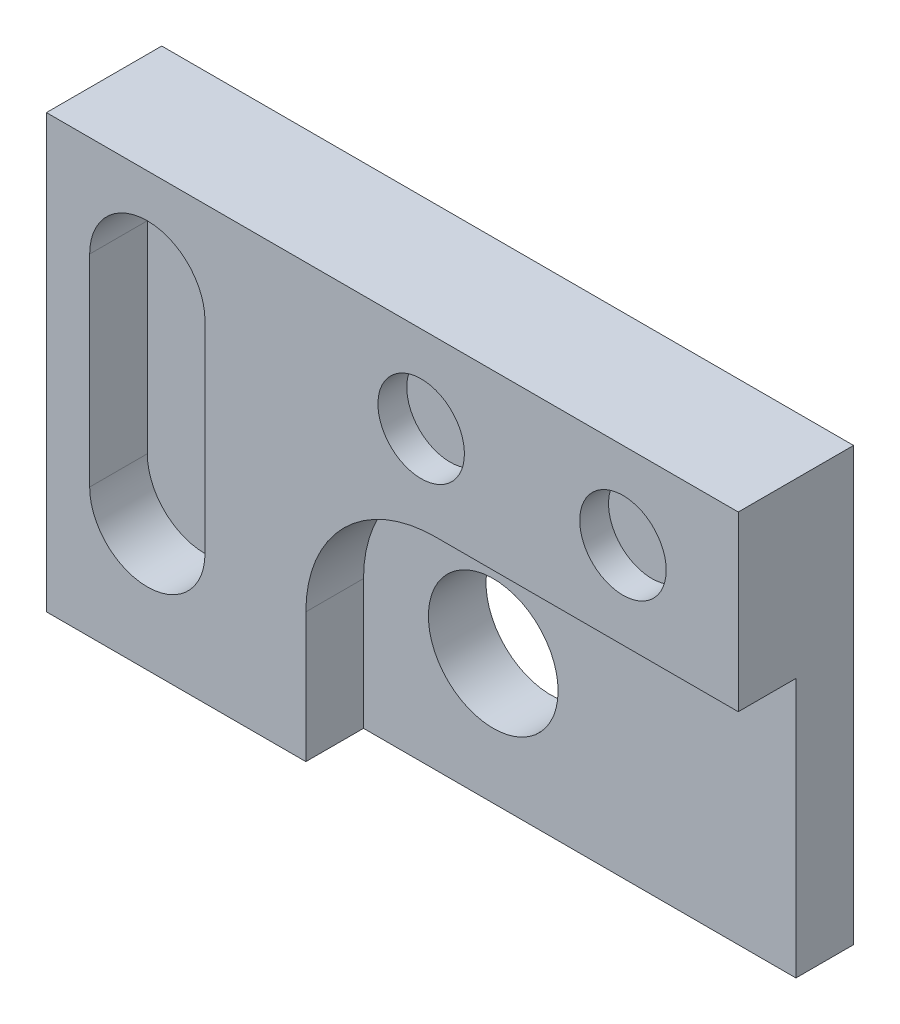
from build123d import *

# Parameters (mm, degrees)
ESQUISSE1_W             = 240
ESQUISSE1_H             = 150
BOSS_EXTRU_1_DEPTH      = 40
ENL_V_MAT_EXTRU_1_DEPTH = 20
ESQUISSE2_3_R           = 15
ENL_V_MAT_EXTRU_2_DEPTH = 10
ESQUISSE2_4_R           = 22.5
ENL_V_MAT_EXTRU_3_DEPTH = 148.054411699
ESQUISSE2_5_R           = 22.5
ENL_V_MAT_EXTRU_4_DEPTH = 20


with BuildPart() as part:
    # Esquisse1 → Boss.-Extru.1 (new body)
    with BuildSketch(Plane.XY):
        Rectangle(ESQUISSE1_W, ESQUISSE1_H)
    extrude(amount=BOSS_EXTRU_1_DEPTH)

    # Esquisse2 → Enlèv. mat.-Extru.1 (cut)
    with BuildSketch(Plane.XY.offset(40)):
        with BuildLine():
            Line((-105, 40), (-105, -30))
            ThreePointArc((-105, -30), (-85, -50), (-65, -30))
            Line((-65, -30), (-65, 40))
            ThreePointArc((-65, 40), (-85, 60), (-105, 40))
        make_face()
    extrude(amount=-ENL_V_MAT_EXTRU_1_DEPTH, mode=Mode.SUBTRACT)

    # Esquisse2<3> → Enlèv. mat.-Extru.2 (cut)
    with BuildSketch(Plane.XY.offset(40)):
        with Locations((10, 45)):
            Circle(ESQUISSE2_3_R)
        with Locations((80, 45)):
            Circle(ESQUISSE2_3_R)
    extrude(amount=-ENL_V_MAT_EXTRU_2_DEPTH, mode=Mode.SUBTRACT)

    # Esquisse2<4> → Enlèv. mat.-Extru.3 (cut, through all)
    with BuildSketch(Plane.XY.offset(40)):
        with Locations((15, -30)):
            Circle(ESQUISSE2_4_R)
    extrude(amount=-ENL_V_MAT_EXTRU_3_DEPTH, mode=Mode.SUBTRACT)

    # Esquisse2<5> → Enlèv. mat.-Extru.4 (cut)
    with BuildSketch(Plane.XY.offset(40)):
        with BuildLine():
            Line((120, -75), (120, 15))
            Line((120, 15), (15, 15))
            ThreePointArc((15, 15), (-16.819805153, 1.819805153), (-30, -30))
            Line((-30, -30), (-30, -75))
            Line((-30, -75), (120, -75))
        make_face()
        with Locations((15, -30)):
            Circle(ESQUISSE2_5_R, mode=Mode.SUBTRACT)
    extrude(amount=-ENL_V_MAT_EXTRU_4_DEPTH, mode=Mode.SUBTRACT)


solid = part.part
